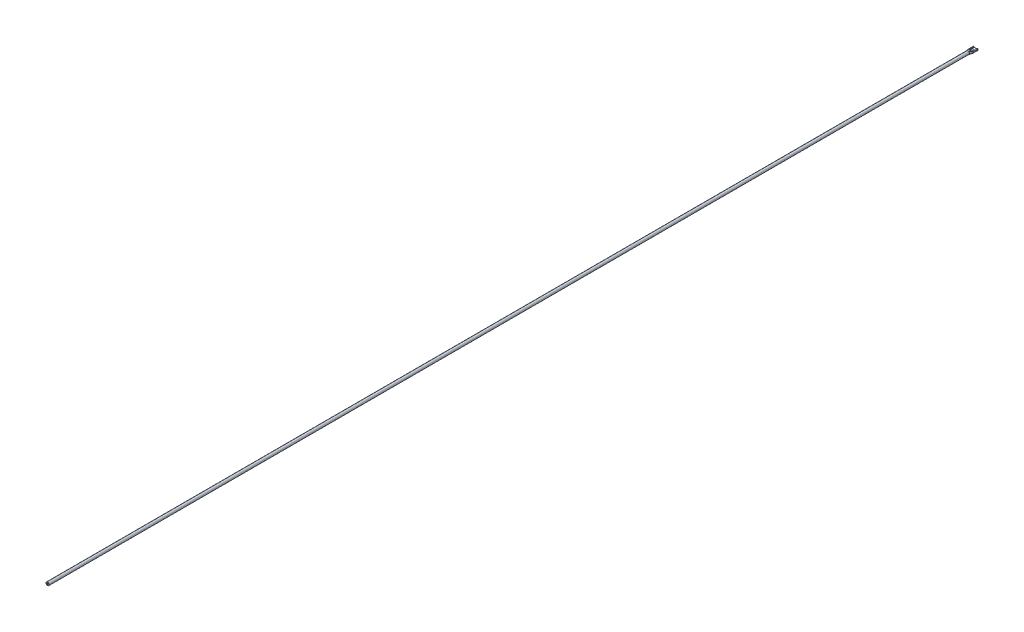
from build123d import *

# Parameters (mm, degrees)
ESQUISSE1_R            = 15
BOSS_EXTRU_1_DEPTH     = 450
SKETCH4_W              = 29.393876914
SKETCH4_H              = 12
CUT_EXTRUDE1_DEPTH     = 32
CUT_EXTRUDE2_DEPTH     = 3.75
SKETCH6_W              = 0.5
SKETCH6_H              = 2.288675135
CUT_EXTRUDE3_DEPTH     = 3.75
FILLET1_R              = 0.5
FILLET2_R              = 1.5
CUT_EXTRUDE4_DEPTH     = 15
CUT_EXTRUDE5_DEPTH     = 15
SKETCH11_W             = 0.7
SKETCH11_H             = 0.404145188
SKETCH11_H_2           = 1.772825297
CUT_EXTRUDE7_DEPTH     = 3.75
SKETCH12_R             = 10
BOSS_EXTRUDE1_DEPTH    = 5550
M10_TAPPED_HOLE1_D     = 8.5
M10_TAPPED_HOLE1_DEPTH = 27.5
M10_TAPPED_HOLE1_TIP   = 2.553657631
M4_TAPPED_HOLE1_D      = 3.3
M4_TAPPED_HOLE1_DEPTH  = 11.5
M4_TAPPED_HOLE1_TIP    = 0.991420021


with BuildPart() as part:
    # Esquisse1 → Boss.-Extru.1 (new body)
    with BuildSketch(Plane.XY):
        Circle(ESQUISSE1_R)
    extrude(amount=BOSS_EXTRU_1_DEPTH)

    # Sketch4 → Cut-Extrude1 (cut)
    with BuildSketch(Plane(origin=(0, 0, 0), x_dir=(-1, 0, 0), z_dir=(0, 0, -1))):
        with Locations((0, 9)):
            Rectangle(SKETCH4_W, SKETCH4_H)
    extrude(amount=-CUT_EXTRUDE1_DEPTH, mode=Mode.SUBTRACT)

    # Sketch5 → Cut-Extrude2 (cut)
    with BuildSketch(Plane(origin=(0, 3, 0), x_dir=(1, 0, 0), z_dir=(0, 1, 0))):
        Polygon((0, 0), (0, -32), (-10, -32), (-10, -27.943769062), (-3, -23.902317178), (-3, -21.902317178), (-12.5, -18.444599952), (-12.5, -15.944599952), (-6.5, -12.480498337), (-6.5, -10.480498337), (-15, -7.386751346), (-15, -4.886751346), (-10, -2), (-10, 0), align=None)
    cut_extrude2 = extrude(amount=-CUT_EXTRUDE2_DEPTH, mode=Mode.SUBTRACT)

    # Sketch6 → Cut-Extrude3 (cut)
    with BuildSketch(Plane(origin=(0, 3, 0), x_dir=(1, 0, 0), z_dir=(0, 1, 0))):
        with Locations((-10.25, -1.144337568)):
            Rectangle(SKETCH6_W, SKETCH6_H)
        Polygon((-6.75, -12.624835905), (-6.75, -10.921594665), (-15, -7.918840232), (-15, -7.386751346), (-6.5, -10.480498337), (-6.5, -12.480498337), align=None)
        Polygon((-12.5, -15.944599952), (-13, -16.233275087), (-13, -18.794703721), (-3.25, -22.343413506), (-3.25, -24.046654745), (-3, -23.902317178), (-3, -21.902317178), (-12.5, -18.444599952), align=None)
        Polygon((-10, -32), (-10, -27.943769062), (-10.5, -28.232444197), (-10.5, -32), align=None)
    cut_extrude3 = extrude(amount=-CUT_EXTRUDE3_DEPTH, mode=Mode.SUBTRACT)

    # Mirror2: Cut-Extrude2, Cut-Extrude3 across plane
    add(cut_extrude2.mirror(Plane(origin=(0, 0, 0), x_dir=(0, 0, 1), z_dir=(1, 0, 0))), mode=Mode.SUBTRACT)
    add(cut_extrude3.mirror(Plane(origin=(0, 0, 0), x_dir=(0, 0, 1), z_dir=(1, 0, 0))), mode=Mode.SUBTRACT)

    # Fillet1
    fillet1_edges = [part.edges().sort_by_distance(p)[0] for p in [
        (-3.25, 1.125, 22.343413506),
        (-3.25, 1.125, 24.046654745),
        (10.5, 1.125, 2.288675135),
        (6.75, 1.125, 12.624835905),
        (6.75, 1.125, 10.921594665),
        (3.25, 1.125, 22.343413506),
        (3.25, 1.125, 24.046654745),
        (-10.5, 1.125, 2.288675135),
        (-6.75, 1.125, 10.921594665),
        (-6.75, 1.125, 12.624835905),
    ]]
    fillet(fillet1_edges, radius=FILLET1_R)

    # Fillet2
    fillet2_edges = [part.edges().sort_by_distance(p)[0] for p in [
        (-13, 1.125, 16.233275087),
        (-13, 1.125, 18.794703721),
        (-10.5, 1.125, 28.232444197),
        (-10.5, 1.125, 32),
        (13, 1.125, 16.233275087),
        (13, 1.125, 18.794703721),
        (10.5, 1.125, 32),
        (10.5, 1.125, 28.232444197),
    ]]
    fillet(fillet2_edges, radius=FILLET2_R)

    # Sketch7 → Cut-Revolve1 (revolve, cut)
    with BuildSketch(Plane(origin=(0, 0, 0), x_dir=(1, 0, 0), z_dir=(0, 1, 0))):
        Polygon((10, -450), (10, -50.660254038), (15, -32), (15, -450), align=None)
    revolve(axis=Axis((0, 0, 450), (0, 0, -1)), mode=Mode.SUBTRACT)

    # Sketch8 → Cut-Extrude4 (cut, symmetric)
    with BuildSketch(Plane(origin=(0, 0, 0), x_dir=(0, 0, -1), z_dir=(1, 0, 0))):
        Polygon((-52.660254038, 10), (-32, 15), (-32, 10), (-32, 3), (-34, 3), align=None)
    extrude(amount=CUT_EXTRUDE4_DEPTH, both=True, mode=Mode.SUBTRACT)

    # Sketch9 → Cut-Extrude5 (cut, symmetric)
    with BuildSketch(Plane(origin=(0, 0, 0), x_dir=(0, 0, -1), z_dir=(1, 0, 0))):
        Polygon((0, -8), (0, -15), (-52.660254038, -15), (-52.660254038, -10), (-34, -8), align=None)
    extrude(amount=CUT_EXTRUDE5_DEPTH, both=True, mode=Mode.SUBTRACT)

    # Sketch11 → Cut-Extrude7 (cut)
    with BuildSketch(Plane(origin=(0, 3, 0), x_dir=(1, 0, 0), z_dir=(0, 1, 0))):
        with Locations((14.65, -4.684678752)):
            Rectangle(SKETCH11_W, SKETCH11_H)
        with Locations((-14.65, -4.684678752)):
            Rectangle(SKETCH11_W, SKETCH11_H)
        with Locations((14.65, -7.287206748)):
            Rectangle(SKETCH11_W, SKETCH11_H_2)
        with Locations((-14.65, -7.287206748)):
            Rectangle(SKETCH11_W, SKETCH11_H_2)
    extrude(amount=-CUT_EXTRUDE7_DEPTH, mode=Mode.SUBTRACT)

    # Sketch12 → Boss-Extrude1 (add)
    with BuildSketch(Plane.XY.offset(450)):
        Circle(SKETCH12_R)
    extrude(amount=BOSS_EXTRUDE1_DEPTH)

    # M10 Tapped Hole1
    with Locations(Plane.XY.offset(6000)):
        with Locations((0, 0)):
            Hole(M10_TAPPED_HOLE1_D / 2, depth=M10_TAPPED_HOLE1_DEPTH)
            with Locations((0, 0, -(M10_TAPPED_HOLE1_DEPTH + M10_TAPPED_HOLE1_TIP / 2))):  # 118° drill point
                Cone(0, M10_TAPPED_HOLE1_D / 2, M10_TAPPED_HOLE1_TIP, mode=Mode.SUBTRACT)

    # M4 Tapped Hole1
    with Locations(Plane(origin=(0, -0.75, 0), x_dir=(1, 0, 0), z_dir=(0, 1, 0))):
        with Locations((0, -16.5)):
            Hole(M4_TAPPED_HOLE1_D / 2, depth=M4_TAPPED_HOLE1_DEPTH)
            with Locations((0, 0, -(M4_TAPPED_HOLE1_DEPTH + M4_TAPPED_HOLE1_TIP / 2))):  # 118° drill point
                Cone(0, M4_TAPPED_HOLE1_D / 2, M4_TAPPED_HOLE1_TIP, mode=Mode.SUBTRACT)


solid = part.part
